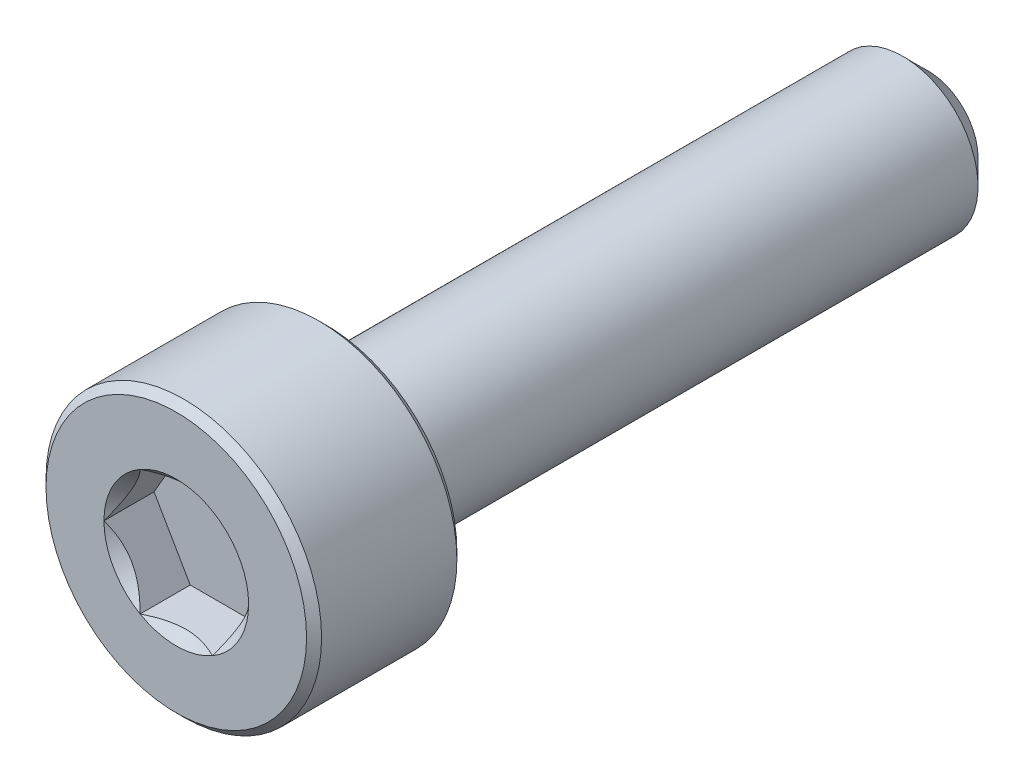
from build123d import *

# Parameters (mm, degrees)
CUT_EXTRUDE1_DEPTH = 1
SKETCH4_R          = 1.443375673
CUT_EXTRUDE2_DEPTH = 0.5
CUT_EXTRUDE2_DRAFT = -45


with BuildPart() as part:
    # Sketch2 → Revolve1 (revolve)
    with BuildSketch(Plane(origin=(0, 0, 0), x_dir=(0, 0, -1), z_dir=(1, 0, 0)), mode=Mode.PRIVATE) as revolve1_sk:
        Polygon((-7.35, 2.75), (-4.65, 2.75), (-4.5, 2.6), (-4.5, 1.5), (7, 1.5), (7.5, 1), (7.5, 0), (-7.5, 0), (-7.5, 2.6), align=None)
    revolve(revolve1_sk.sketch.rotate(Axis((0, 0, -7.5), (0, 0, 1)), 90), axis=Axis((0, 0, -7.5), (0, 0, 1)))

    # Sketch3 → Cut-Extrude1 (cut)
    with BuildSketch(Plane.XY.offset(7.5)):
        Polygon((0.721687836, 1.25), (-0.721687836, 1.25), (-1.443375673, 0), (-0.721687836, -1.25), (0.721687836, -1.25), (1.443375673, 0), align=None)
    extrude(amount=-CUT_EXTRUDE1_DEPTH, mode=Mode.SUBTRACT)


with BuildPart() as cut_extrude2_tool:
    # Sketch4 → Cut-Extrude2 (with draft: the straight prism first)
    with BuildSketch(Plane.XY.offset(7.5)):
        Circle(SKETCH4_R)
    extrude(amount=-CUT_EXTRUDE2_DEPTH)
    # Cut-Extrude2: the draft: its side faces are tilted about the plane it starts from
    cut_extrude2_sides = [cut_extrude2_tool.faces().sort_by_distance(p)[0] for p in [
        (-1.443375673, 0, 7.25),
    ]]
    draft(cut_extrude2_sides, Plane.XY.offset(7.5), CUT_EXTRUDE2_DRAFT)


with BuildPart() as part_1:
    add(part.part)

    # Cut-Extrude2: cut by cut_extrude2_tool
    add(cut_extrude2_tool.part, mode=Mode.SUBTRACT)


solid = part_1.part
